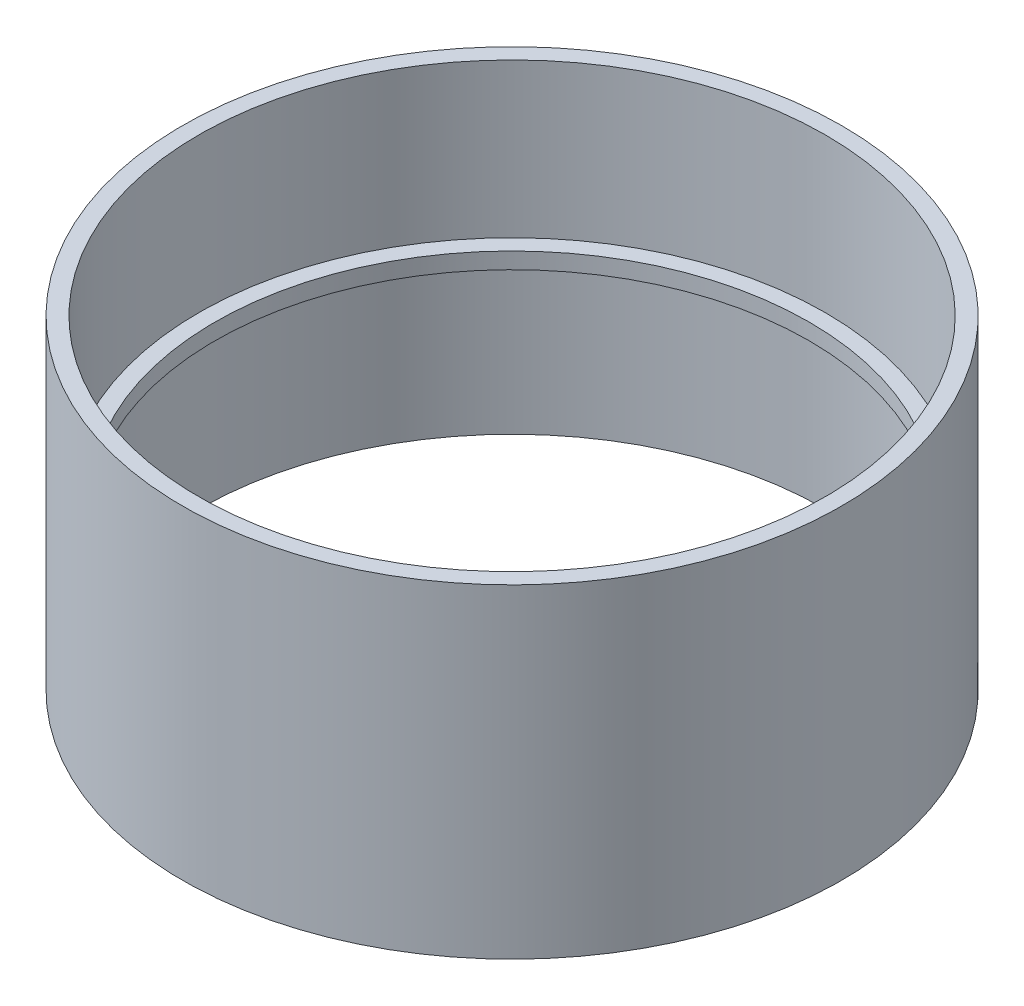
from build123d import *

# Parameters (mm, degrees)
SKETCH1_W   = 1.5
SKETCH1_H   = 1.5
SKETCH1_H_2 = 30


with BuildPart() as part:
    # Sketch1 → Revolve1 (revolve)
    with BuildSketch(Plane.XY, mode=Mode.PRIVATE) as revolve1_sk:
        with Locations((28.25, 15)):
            Rectangle(SKETCH1_W, SKETCH1_H)
        with Locations((29.75, 15)):
            Rectangle(SKETCH1_W, SKETCH1_H_2)
    revolve(revolve1_sk.sketch.rotate(Axis((0, 0, 0), (0, 1, 0)), 90), axis=Axis((0, 0, 0), (0, 1, 0)))


solid = part.part
